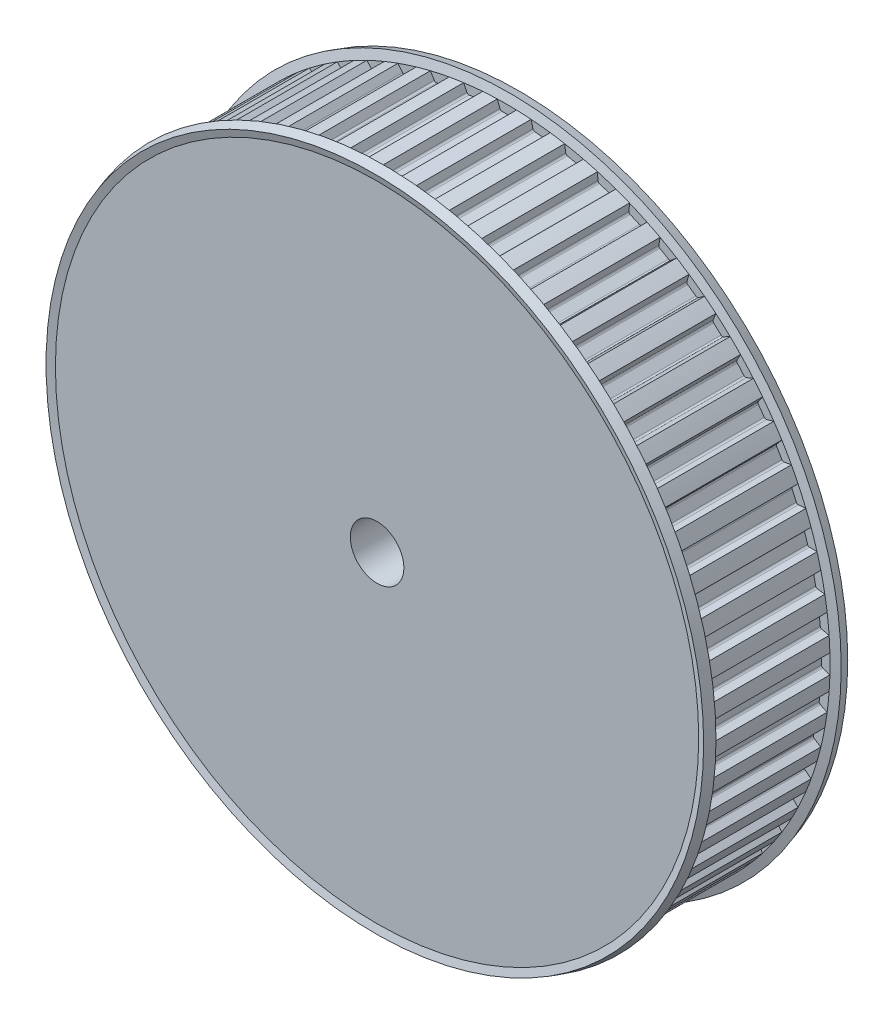
from build123d import *

# Parameters (mm, degrees)
SKETCH1_R        = 19.1516
BASEPULLEY_DEPTH = 7.112
GROOVE_DEPTH     = 3.556
GROOVES_COUNT    = 60
GROOVES_ANGLE    = 354
SKETCH4_W        = 8.128
SKETCH4_H        = 6.35
BORSKE_R         = 1.5875
BORE_DEPTH       = 30.174996708


with BuildPart() as part:
    # Sketch1 → BasePulley (new body)
    with BuildSketch(Plane.XY):
        Circle(SKETCH1_R)
    extrude(amount=-BASEPULLEY_DEPTH)

    # Sketch2 → Flange (revolve)
    with BuildSketch(Plane(origin=(0, 0, 0), x_dir=(0, 0, -1), z_dir=(1, 0, 0)), mode=Mode.PRIVATE) as flange_sk:
        Polygon((7.112, 19.1516), (7.267311186, 19.6596), (7.825984425, 19.48879645), (7.6962, 19.064290725), (7.6962, 0), (-0.5842, 0), (-0.5842, 19.064290725), (-0.713984425, 19.48879645), (-0.155311186, 19.6596), (0, 19.1516), align=None)
    revolve(flange_sk.sketch.rotate(Axis((0, 0, 0), (0, 0, -1)), 90), axis=Axis((0, 0, 0), (0, 0, -1)))

    # Sketch3 → Groove (cut, symmetric)
    with BuildSketch(Plane.XY.offset(-3.556)):
        with BuildLine():
            Line((-0.5715, 19.1516), (-0.5715, 44.5516))
            Line((-0.5715, 44.5516), (0.5715, 44.5516))
            Line((0.5715, 44.5516), (0.5715, 19.1516))
            Line((0.5715, 19.1516), (0.417017726, 18.727163442))
            ThreePointArc((0.417017726, 18.727163442), (0.370520971, 18.66656769), (0.297676764, 18.6436))
            Line((0.297676764, 18.6436), (-0.297676764, 18.6436))
            ThreePointArc((-0.297676764, 18.6436), (-0.370520971, 18.66656769), (-0.417017726, 18.727163442))
            Line((-0.417017726, 18.727163442), (-0.5715, 19.1516))
        make_face()
    groove = extrude(amount=GROOVE_DEPTH, both=True, mode=Mode.SUBTRACT)

    # Grooves: Groove ×60 about axis
    grooves_axis = Axis((0, 0, -7.112), (0, 0, 1))
    for i in range(1, GROOVES_COUNT):
        add(groove.rotate(grooves_axis, i * GROOVES_ANGLE / (GROOVES_COUNT - 1)), mode=Mode.SUBTRACT)

    # Sketch4 → BaseHub (revolve)
    with BuildSketch(Plane(origin=(0, 0, 0), x_dir=(0, 0, -1), z_dir=(1, 0, 0)), mode=Mode.PRIVATE) as basehub_sk:
        with Locations((4.064, 3.175)):
            Rectangle(SKETCH4_W, SKETCH4_H)
    revolve(basehub_sk.sketch.rotate(Axis((0, 0, 0), (0, 0, -1)), 271.700816991), axis=Axis((0, 0, 0), (0, 0, -1)))

    # BorSke → Bore (cut, through all)
    with BuildSketch(Plane(origin=(0, 0, -8.128), x_dir=(-1, 0, 0), z_dir=(0, 0, -1))):
        Circle(BORSKE_R)
    extrude(amount=-BORE_DEPTH, mode=Mode.SUBTRACT)


solid = part.part
